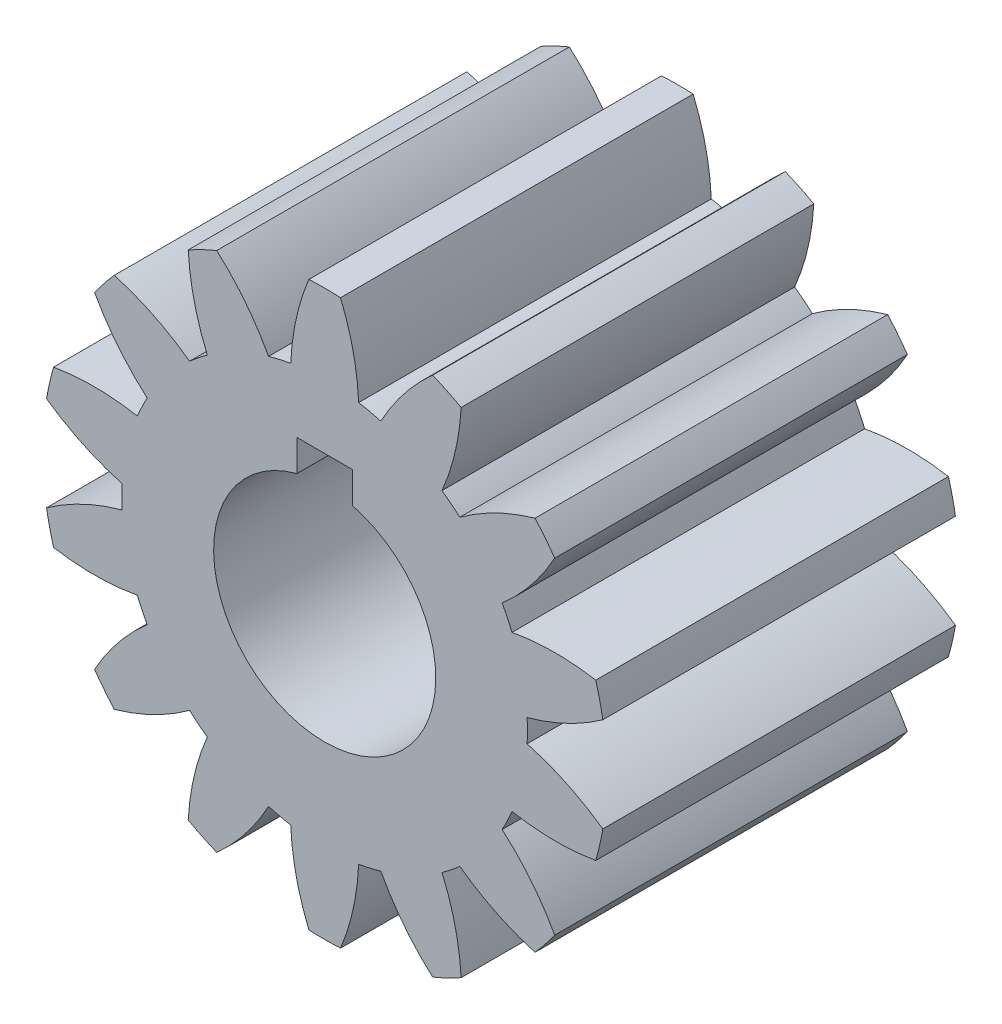
from build123d import *

# Parameters (mm, degrees)
EXTRUDE1_DEPTH      = 6.35
EXTRUDE2_DEPTH      = 16.616573297
EXTRUDE2_DEPTH_BACK = 16.616573297


with BuildPart() as part:
    # Sketch1 → Extrude1 (new, symmetric)
    with BuildSketch(Plane.XY):
        with BuildLine():
            ThreePointArc((3.888063673, 9.38661605), (2.850463577, 8.284065014), (2.021591322, 7.017098744))
            ThreePointArc((2.021591322, 7.017098744), (1.62495912, 7.119411079), (1.223214196, 7.199323113))
            ThreePointArc((1.223214196, 7.199323113), (1.026142161, 8.700454472), (0.569675744, 10.144016441))
            ThreePointArc((0.569675744, 10.144016441), (0, 10.16), (-0.569675744, 10.144016441))
            ThreePointArc((-0.569675744, 10.144016441), (-1.026142161, 8.700454472), (-1.223214196, 7.199323113))
            ThreePointArc((-1.223214196, 7.199323113), (-1.62495912, 7.119411079), (-2.021591322, 7.017098744))
            ThreePointArc((-2.021591322, 7.017098744), (-2.850463577, 8.284065014), (-3.888063673, 9.38661605))
            ThreePointArc((-3.888063673, 9.38661605), (-4.408258789, 9.153843698), (-4.914583893, 8.892269967))
            ThreePointArc((-4.914583893, 8.892269967), (-4.69950786, 7.393612219), (-4.22574714, 5.955633246))
            ThreePointArc((-4.22574714, 5.955633246), (-4.553034278, 5.709324401), (-4.865995885, 5.445051909))
            ThreePointArc((-4.865995885, 5.445051909), (-6.162500046, 6.226914882), (-7.575724395, 6.770081232))
            ThreePointArc((-7.575724395, 6.770081232), (-7.943407862, 6.334656387), (-8.286098429, 5.879300369))
            ThreePointArc((-8.286098429, 5.879300369), (-7.442078391, 4.622374388), (-6.391319038, 3.532357173))
            ThreePointArc((-6.391319038, 3.532357173), (-6.579325158, 3.168436005), (-6.746630286, 2.794545765))
            ThreePointArc((-6.746630286, 2.794545765), (-8.253977802, 2.93644789), (-9.762919991, 2.812648796))
            ThreePointArc((-9.762919991, 2.812648796), (-9.905267588, 2.260812689), (-10.016449548, 1.701863229))
            ThreePointArc((-10.016449548, 1.701863229), (-8.710654026, 0.93561862), (-7.291011817, 0.409454441))
            ThreePointArc((-7.291011817, 0.409454441), (-7.3025, 0), (-7.291011817, -0.409454441))
            ThreePointArc((-7.291011817, -0.409454441), (-8.710654026, -0.93561862), (-10.016449548, -1.701863229))
            ThreePointArc((-10.016449548, -1.701863229), (-9.905267588, -2.260812689), (-9.762919991, -2.812648796))
            ThreePointArc((-9.762919991, -2.812648796), (-8.253977802, -2.93644789), (-6.746630286, -2.794545765))
            ThreePointArc((-6.746630286, -2.794545765), (-6.579325158, -3.168436005), (-6.391319038, -3.532357173))
            ThreePointArc((-6.391319038, -3.532357173), (-7.442078391, -4.622374388), (-8.286098429, -5.879300369))
            ThreePointArc((-8.286098429, -5.879300369), (-7.943407862, -6.334656387), (-7.575724395, -6.770081232))
            ThreePointArc((-7.575724395, -6.770081232), (-6.162500046, -6.226914882), (-4.865995885, -5.445051909))
            ThreePointArc((-4.865995885, -5.445051909), (-4.553034278, -5.709324401), (-4.22574714, -5.955633246))
            ThreePointArc((-4.22574714, -5.955633246), (-4.69950786, -7.393612219), (-4.914583893, -8.892269967))
            ThreePointArc((-4.914583893, -8.892269967), (-4.408258789, -9.153843698), (-3.888063673, -9.38661605))
            ThreePointArc((-3.888063673, -9.38661605), (-2.850463577, -8.284065014), (-2.021591322, -7.017098744))
            ThreePointArc((-2.021591322, -7.017098744), (-1.62495912, -7.119411079), (-1.223214196, -7.199323113))
            ThreePointArc((-1.223214196, -7.199323113), (-1.026142161, -8.700454472), (-0.569675744, -10.144016441))
            ThreePointArc((-0.569675744, -10.144016441), (0, -10.16), (0.569675744, -10.144016441))
            ThreePointArc((0.569675744, -10.144016441), (1.026142161, -8.700454472), (1.223214196, -7.199323113))
            ThreePointArc((1.223214196, -7.199323113), (1.62495912, -7.119411079), (2.021591322, -7.017098744))
            ThreePointArc((2.021591322, -7.017098744), (2.850463577, -8.284065014), (3.888063673, -9.38661605))
            ThreePointArc((3.888063673, -9.38661605), (4.408258789, -9.153843698), (4.914583893, -8.892269967))
            ThreePointArc((4.914583893, -8.892269967), (4.69950786, -7.393612219), (4.22574714, -5.955633246))
            ThreePointArc((4.22574714, -5.955633246), (4.553034278, -5.709324401), (4.865995885, -5.445051909))
            ThreePointArc((4.865995885, -5.445051909), (6.162500046, -6.226914882), (7.575724395, -6.770081232))
            ThreePointArc((7.575724395, -6.770081232), (7.943407862, -6.334656387), (8.286098429, -5.879300369))
            ThreePointArc((8.286098429, -5.879300369), (7.442078391, -4.622374388), (6.391319038, -3.532357173))
            ThreePointArc((6.391319038, -3.532357173), (6.579325158, -3.168436005), (6.746630286, -2.794545765))
            ThreePointArc((6.746630286, -2.794545765), (8.253977802, -2.93644789), (9.762919991, -2.812648796))
            ThreePointArc((9.762919991, -2.812648796), (9.905267588, -2.260812689), (10.016449548, -1.701863229))
            ThreePointArc((10.016449548, -1.701863229), (8.710654026, -0.93561862), (7.291011817, -0.409454441))
            ThreePointArc((7.291011817, -0.409454441), (7.3025, 0), (7.291011817, 0.409454441))
            ThreePointArc((7.291011817, 0.409454441), (8.710654026, 0.93561862), (10.016449548, 1.701863229))
            ThreePointArc((10.016449548, 1.701863229), (9.905267588, 2.260812689), (9.762919991, 2.812648796))
            ThreePointArc((9.762919991, 2.812648796), (8.253977802, 2.93644789), (6.746630286, 2.794545765))
            ThreePointArc((6.746630286, 2.794545765), (6.579325158, 3.168436005), (6.391319038, 3.532357173))
            ThreePointArc((6.391319038, 3.532357173), (7.442078391, 4.622374388), (8.286098429, 5.879300369))
            ThreePointArc((8.286098429, 5.879300369), (7.943407862, 6.334656387), (7.575724395, 6.770081232))
            ThreePointArc((7.575724395, 6.770081232), (6.162500046, 6.226914882), (4.865995885, 5.445051909))
            ThreePointArc((4.865995885, 5.445051909), (4.553034278, 5.709324401), (4.22574714, 5.955633246))
            ThreePointArc((4.22574714, 5.955633246), (4.69950786, 7.393612219), (4.914583893, 8.892269967))
            ThreePointArc((4.914583893, 8.892269967), (4.408258789, 9.153843698), (3.888063673, 9.38661605))
        make_face()
    extrude(amount=EXTRUDE1_DEPTH, both=True)

    # Sketch2 → Extrude2 (cut, two sides: drawn at the far end of the back side and taken through both)
    with BuildSketch(Plane.XY.offset(-EXTRUDE2_DEPTH_BACK)):
        with BuildLine():
            Line((-0.999998, 3.872983863), (-0.999998, 5.000000516))
            Line((-0.999998, 5.000000516), (0.999998, 5.000000516))
            Line((0.999998, 5.000000516), (0.999998, 3.872983863))
            ThreePointArc((0.999998, 3.872983863), (0, -4), (-0.999998, 3.872983863))
        make_face()
    extrude(amount=EXTRUDE2_DEPTH + EXTRUDE2_DEPTH_BACK, mode=Mode.SUBTRACT)


solid = part.part
